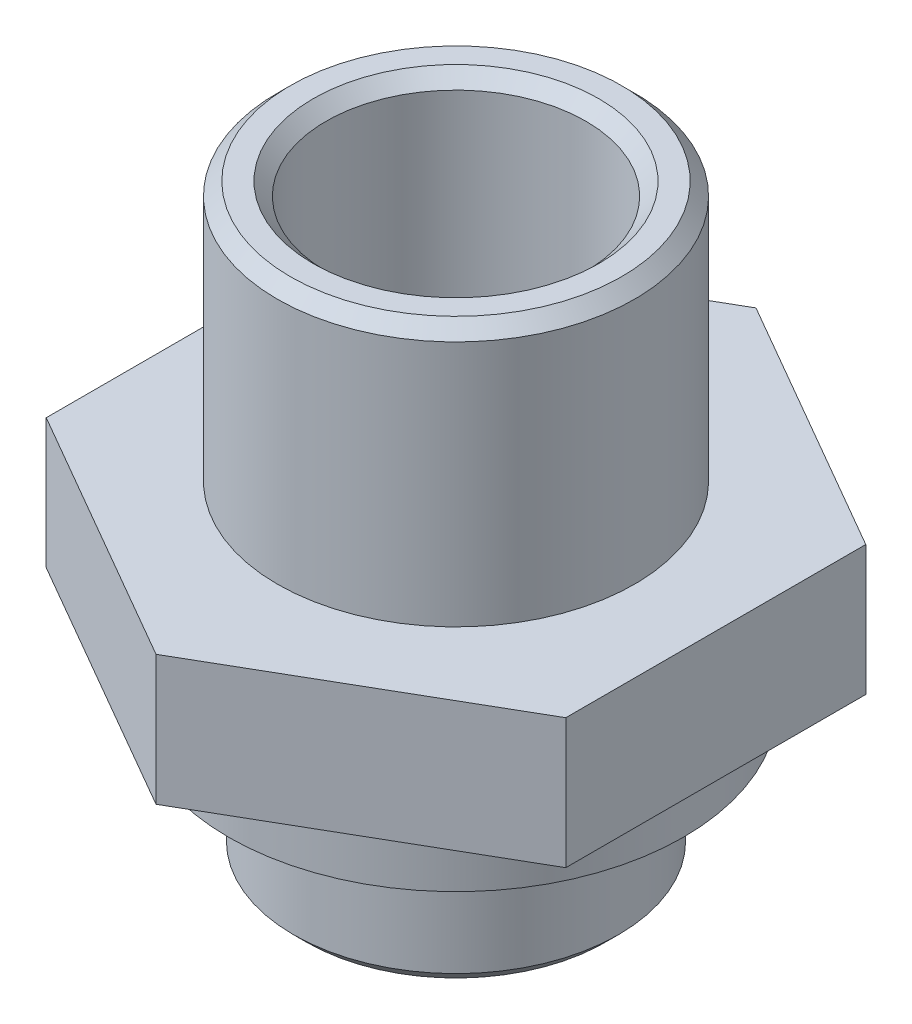
from build123d import *

# Parameters (mm, degrees)
BOSS_EXTRUDE1_DEPTH = 2
SKETCH2_R           = 2.75
BOSS_EXTRUDE2_DEPTH = 4
SKETCH2_3_R         = 2
CUT_EXTRUDE1_DEPTH  = 4
SKETCH3_R           = 3.5
BOSS_EXTRUDE3_DEPTH = 1
SKETCH3_4_R         = 2.5
BOSS_EXTRUDE4_DEPTH = 3
SKETCH4_R           = 2
CUT_EXTRUDE3_DEPTH  = 8.895146188
CHAMFER1_SIZE       = 0.2


with BuildPart() as part:
    # Sketch1 → Boss-Extrude1 (new body)
    with BuildSketch(Plane(origin=(0, 0, 0), x_dir=(1, 0, 0), z_dir=(0, 1, 0))):
        Polygon((0, 4.618802154), (-4, 2.309401077), (-4, -2.309401077), (0, -4.618802154), (4, -2.309401077), (4, 2.309401077), align=None)
    extrude(amount=BOSS_EXTRUDE1_DEPTH)

    # Sketch2 → Boss-Extrude2 (add)
    with BuildSketch(Plane(origin=(0, 2, 0), x_dir=(1, 0, 0), z_dir=(0, 1, 0))):
        Circle(SKETCH2_R)
    extrude(amount=BOSS_EXTRUDE2_DEPTH)

    # Sketch2<3> → Cut-Extrude1 (cut)
    with BuildSketch(Plane(origin=(0, 2, 0), x_dir=(1, 0, 0), z_dir=(0, 1, 0))):
        Circle(SKETCH2_3_R)
    extrude(amount=CUT_EXTRUDE1_DEPTH, mode=Mode.SUBTRACT)

    # Sketch3 → Boss-Extrude3 (add)
    with BuildSketch(Plane.XZ):
        Circle(SKETCH3_R)
    extrude(amount=BOSS_EXTRUDE3_DEPTH)

    # Sketch3<4> → Boss-Extrude4 (add)
    with BuildSketch(Plane.XZ):
        Circle(SKETCH3_4_R)
    extrude(amount=BOSS_EXTRUDE4_DEPTH)

    # Sketch4 → Cut-Extrude3 (cut, through all)
    with BuildSketch(Plane(origin=(0, 2, 0), x_dir=(1, 0, 0), z_dir=(0, 1, 0))):
        Circle(SKETCH4_R)
    extrude(amount=-CUT_EXTRUDE3_DEPTH, mode=Mode.SUBTRACT)

    # Chamfer1
    chamfer1_edges = [part.edges().sort_by_distance(p)[0] for p in [
        (-2.75, 6, 0),
        (-2, 6, 0),
        (-2.5, -3, 0),
        (-2, -3, 0),
    ]]
    chamfer(chamfer1_edges, length=CHAMFER1_SIZE)


solid = part.part
